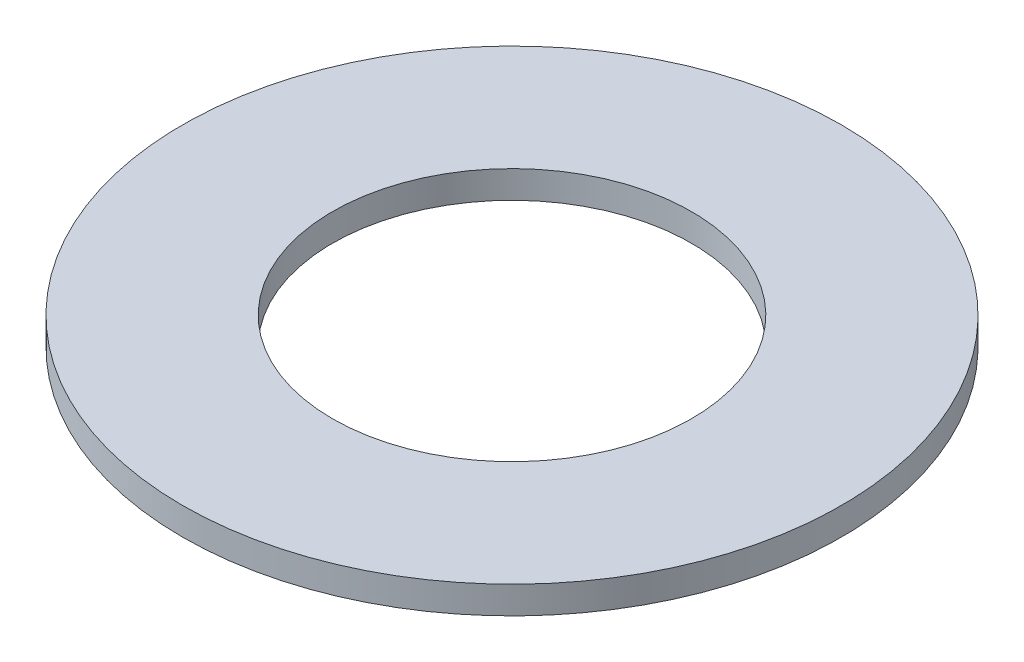
from build123d import *

# Parameters (mm, degrees)
SKETCH1_R           = 38.1
SKETCH1_R_2         = 20.7518
BOSS_EXTRUDE1_DEPTH = 3.175


with BuildPart() as part:
    # Sketch1 → Boss-Extrude1 (new body)
    with BuildSketch(Plane(origin=(0, 0, 0), x_dir=(1, 0, 0), z_dir=(0, 1, 0))):
        with Locations(Location((0, 0, 0), (0, 0, 270))):
            Circle(SKETCH1_R)
        with Locations(Location((0, 0, 0), (0, 0, 270))):
            Circle(SKETCH1_R_2, mode=Mode.SUBTRACT)
    extrude(amount=BOSS_EXTRUDE1_DEPTH)


solid = part.part
